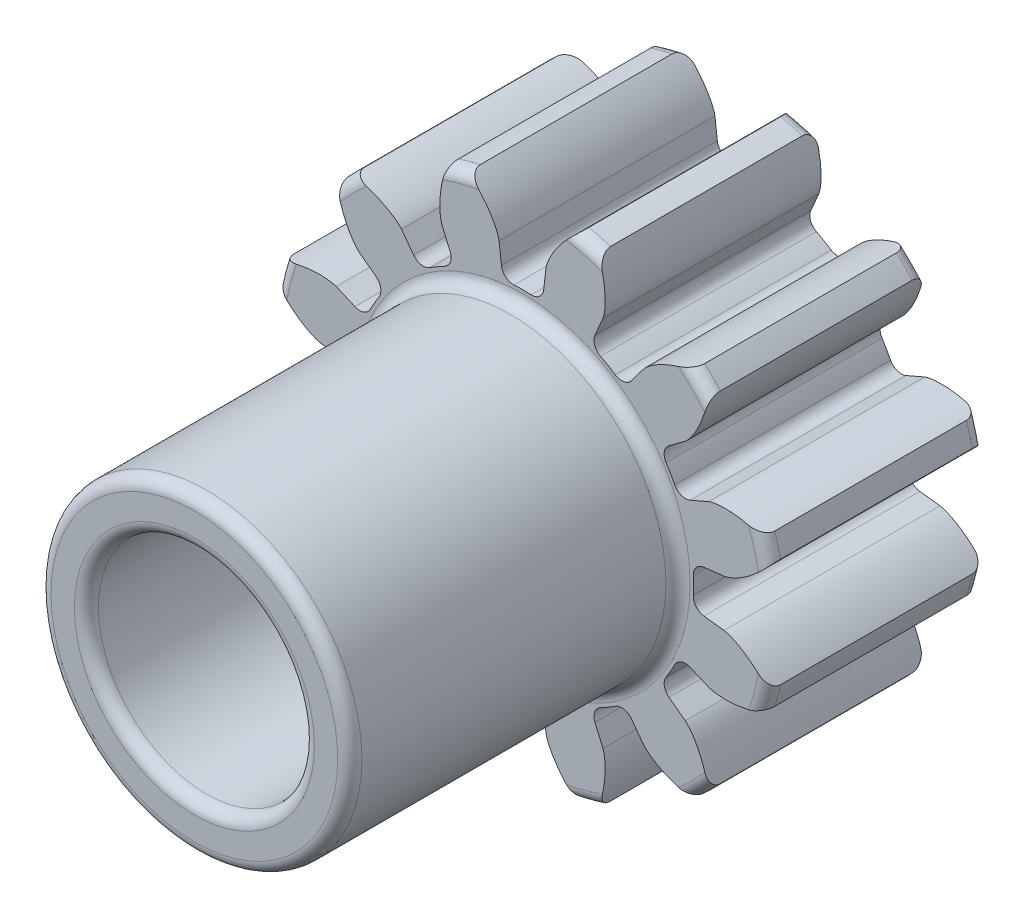
from build123d import *

# Parameters (mm, degrees)
BOSS_EXTRUDE1_DEPTH      = 4.0005
BOSS_EXTRUDE1_DEPTH_BACK = 4.0005
SKETCH3_R                = 3.704166667
SKETCH5_W                = 4.826
SKETCH5_H                = 1.418166667
SKETCH5_W_2              = 8.001
SKETCH5_H_2              = 1.5875
FILLET2_R                = 0.177538081
CUT_EXTRUDE1_DEPTH       = 7.591335458
FILLET1_R                = 0.177538081
CIRPATTERN1_COUNT        = 12
FILLET1_OF_CIRPATTERN1_R = 0.177538081


with BuildPart() as part:
    # Sketch3 → Boss-Extrude1 (new, two sides: drawn at the far end of the back side and taken through both)
    with BuildSketch(Plane.XY.offset(-BOSS_EXTRUDE1_DEPTH_BACK)):
        Circle(SKETCH3_R)
    extrude(amount=BOSS_EXTRUDE1_DEPTH + BOSS_EXTRUDE1_DEPTH_BACK)

    # Sketch5 → Cut-Revolve1 (revolve, cut)
    with BuildSketch(Plane(origin=(0, 0, 0), x_dir=(0, 0, -1), z_dir=(1, 0, 0)), mode=Mode.PRIVATE) as cut_revolve1_sk:
        with Locations((-1.5875, 2.995083334)):
            Rectangle(SKETCH5_W, SKETCH5_H)
        with Locations((0, 0.79375)):
            Rectangle(SKETCH5_W_2, SKETCH5_H_2)
    revolve(cut_revolve1_sk.sketch.rotate(Axis((0, 0, 4.0005), (0, 0, -1)), 90), axis=Axis((0, 0, 4.0005), (0, 0, -1)), mode=Mode.SUBTRACT)

    # Fillet2
    fillet2_edges = [part.edges().sort_by_distance(p)[0] for p in [
        (-1.5875, 0, 4.0005),
        (-1.5875, 0, -4.0005),
        (-2.286, 0, 4.0005),
        (-2.286, 0, -0.8255),
        (-3.704166667, 0, -0.8255),
        (-3.704166667, 0, -4.0005),
    ]]
    fillet(fillet2_edges, radius=FILLET2_R)

    # Sketch4 → Cut-Extrude1 (cut, symmetric)
    with BuildSketch(Plane.XY):
        with BuildLine():
            Line((2.496650877, 0.290905668), (2.963475039, 0.345299254))
            add(Edge.make_bspline(
                [(2.963475039, 0.345299254), (2.964659096, 0.345455936), (2.967972324, 0.345952446), (2.974203977, 0.347116222), (2.98431739, 0.34933342), (2.997115424, 0.352624695), (3.013542482, 0.357411174), (3.032733894, 0.363731206), (3.053641165, 0.371386325), (3.076172927, 0.380475229), (3.098449381, 0.390211054), (3.120471247, 0.400540554), (3.142220504, 0.411384623), (3.168331249, 0.42516975), (3.199306385, 0.442599313), (3.234992258, 0.464266865), (3.27482769, 0.490358014), (3.314700488, 0.518545604), (3.353323962, 0.547586394), (3.391603235, 0.578400107), (3.428109694, 0.609255664), (3.465216361, 0.642777425), (3.499057899, 0.674472004), (3.53602833, 0.711575091), (3.565591799, 0.741986459), (3.595313953, 0.774705109), (3.609657981, 0.790820557), (3.616936756, 0.799136534)],
                knots=[0, 0, 0, 0, 0, 0.005376749, 0.015083688, 0.02853182, 0.046610139, 0.064854849, 0.092110525, 0.119476176, 0.146842496, 0.174208854, 0.201574956, 0.228941013, 0.256307345, 0.307035032, 0.361767352, 0.416499661, 0.471231937, 0.525964282, 0.580696615, 0.635428982, 0.690161387, 0.744893688, 0.799626082, 0.854358408, 0.909090915, 0.909090915, 0.909090915, 0.909090915, 0.909090915], degree=4))
            ThreePointArc((3.616936756, 0.799136534), (3.704166667, 0), (3.616936756, -0.799136534))
            add(Edge.make_bspline(
                [(2.963475039, -0.345299254), (2.964659096, -0.345455936), (2.967972324, -0.345952446), (2.974203977, -0.347116222), (2.98431739, -0.34933342), (2.997115424, -0.352624695), (3.013542482, -0.357411174), (3.032733894, -0.363731206), (3.053641165, -0.371386325), (3.076172927, -0.380475229), (3.098449381, -0.390211054), (3.120471247, -0.400540554), (3.142220504, -0.411384623), (3.168331249, -0.42516975), (3.199306385, -0.442599313), (3.234992258, -0.464266865), (3.27482769, -0.490358014), (3.314700488, -0.518545604), (3.353323962, -0.547586394), (3.391603235, -0.578400107), (3.428109694, -0.609255664), (3.465216361, -0.642777425), (3.499057899, -0.674472004), (3.53602833, -0.711575091), (3.565591799, -0.741986459), (3.595313953, -0.774705109), (3.609657981, -0.790820557), (3.616936756, -0.799136534)],
                knots=[0, 0, 0, 0, 0, 0.005376749, 0.015083688, 0.02853182, 0.046610139, 0.064854849, 0.092110525, 0.119476176, 0.146842496, 0.174208854, 0.201574956, 0.228941013, 0.256307345, 0.307035032, 0.361767352, 0.416499661, 0.471231937, 0.525964282, 0.580696615, 0.635428982, 0.690161387, 0.744893688, 0.799626082, 0.854358408, 0.909090915, 0.909090915, 0.909090915, 0.909090915, 0.909090915], degree=4))
            Line((2.963475039, -0.345299254), (2.496650877, -0.290905668))
            ThreePointArc((2.496650877, -0.290905668), (2.513541667, 0), (2.496650877, 0.290905668))
        make_face()
    cut_extrude1 = extrude(amount=CUT_EXTRUDE1_DEPTH, both=True, mode=Mode.SUBTRACT)

    # Fillet1
    fillet1_edges = [part.edges().sort_by_distance(p)[0] for p in [
        (2.496650877, -0.290905668, -2.413),
        (2.496650877, 0.290905668, -2.413),
    ]]
    fillet(fillet1_edges, radius=FILLET1_R)

    # CirPattern1: Cut-Extrude1 ×12 about axis
    cirpattern1_axis = Axis((0, 0, 4.0005), (0, 0, -1))
    for i in range(1, CIRPATTERN1_COUNT):
        add(cut_extrude1.rotate(cirpattern1_axis, i * 360 / CIRPATTERN1_COUNT), mode=Mode.SUBTRACT)

    # Fillet1 of CirPattern1
    fillet1_of_cirpattern1_edges = [part.edges().sort_by_distance(p)[0] for p in [
        (2.01671025, -1.500257137, -2.413),
        (2.307615918, -0.99639374, -2.413),
        (0.99639374, -2.307615918, -2.413),
        (1.500257137, -2.01671025, -2.413),
        (-0.290905668, -2.496650877, -2.413),
        (0.290905668, -2.496650877, -2.413),
        (-1.500257137, -2.01671025, -2.413),
        (-0.99639374, -2.307615918, -2.413),
        (-2.307615918, -0.99639374, -2.413),
        (-2.01671025, -1.500257137, -2.413),
        (-2.496650877, 0.290905668, -2.413),
        (-2.496650877, -0.290905668, -2.413),
        (-2.01671025, 1.500257137, -2.413),
        (-2.307615918, 0.99639374, -2.413),
        (-0.99639374, 2.307615918, -2.413),
        (-1.500257137, 2.01671025, -2.413),
        (0.290905668, 2.496650877, -2.413),
        (-0.290905668, 2.496650877, -2.413),
        (1.500257137, 2.01671025, -2.413),
        (0.99639374, 2.307615918, -2.413),
        (2.307615918, 0.99639374, -2.413),
        (2.01671025, 1.500257137, -2.413),
    ]]
    fillet(fillet1_of_cirpattern1_edges, radius=FILLET1_OF_CIRPATTERN1_R)


solid = part.part
